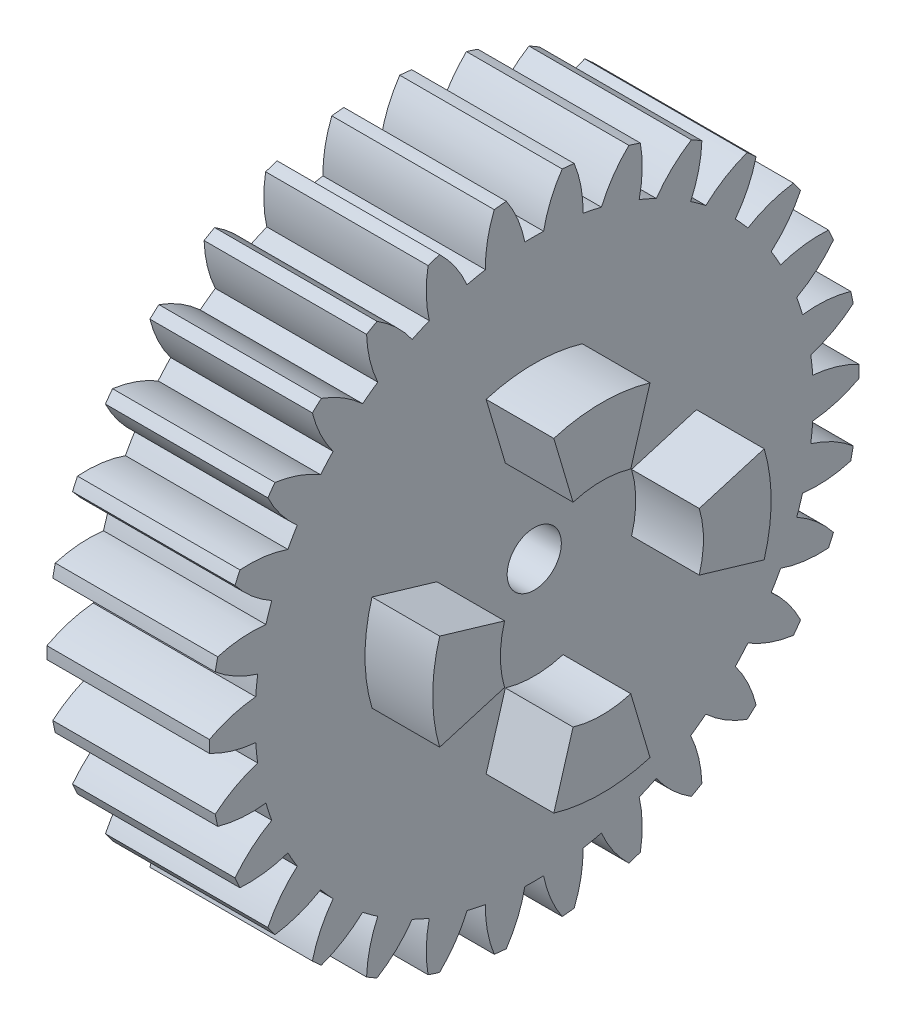
from build123d import *

# Parameters (mm, degrees)
BASPROSKE_W     = 12
BASPROSKE_H     = 24
TOOTHCUT_DEPTH  = 37
TEETHCUTS_COUNT = 30
TEETHCUTS_ANGLE = 348
BORSKE_R        = 2
BORE_DEPTH      = 50.0000508
EXTRUDE_1_DEPTH = 5


with BuildPart() as part:
    # BasProSke → Base-Revolve (revolve)
    with BuildSketch(Plane(origin=(0, 0, 0), x_dir=(1, 0, 0), z_dir=(0, 1, 0)), mode=Mode.PRIVATE) as base_revolve_sk:
        with Locations((6, 12)):
            Rectangle(BASPROSKE_W, BASPROSKE_H)
    revolve(base_revolve_sk.sketch.rotate(Axis((-10, 0, 0), (1, 0, 0)), 180), axis=Axis((-10, 0, 0), (1, 0, 0)))

    # TooCutSke → ToothCut (cut, through all)
    with BuildSketch(Plane(origin=(0, 0, 0), x_dir=(0, 0, -1), z_dir=(1, 0, 0))):
        with BuildLine():
            ThreePointArc((0.693278797, 20.612344372), (0, 20.624), (-0.693278797, 20.612344372))
            ThreePointArc((-0.693278797, 20.612344372), (-1.219042225, 22.34383125), (-2.080549663, 23.935144835))
            ThreePointArc((-2.080549663, 23.935144835), (0, 24.0254), (2.080549663, 23.935144835))
            ThreePointArc((2.080549663, 23.935144835), (1.219042225, 22.34383125), (0.693278797, 20.612344372))
        make_face()
    toothcut = extrude(amount=TOOTHCUT_DEPTH, mode=Mode.SUBTRACT)

    # TeethCuts: ToothCut ×30 about axis
    teethcuts_axis = Axis((-10, 0, 0), (1, 0, 0))
    for i in range(1, TEETHCUTS_COUNT):
        add(toothcut.rotate(teethcuts_axis, i * TEETHCUTS_ANGLE / (TEETHCUTS_COUNT - 1)), mode=Mode.SUBTRACT)

    # BorSke → Bore (cut, symmetric)
    with BuildSketch(Plane(origin=(0, 0, 0), x_dir=(0, 0, -1), z_dir=(1, 0, 0))):
        with Locations(Location((0, 0, 0), (0, 0, 180))):
            Circle(BORSKE_R)
    extrude(amount=BORE_DEPTH, both=True, mode=Mode.SUBTRACT)

    # 草图1 → 凸台-拉伸1 (add)
    with BuildSketch(Plane(origin=(12, 0, 0), x_dir=(0, 0, -1), z_dir=(1, 0, 0))):
        with BuildLine():
            Line((-2.13181457, 7.190644383), (-3.553024283, 11.984407305))
            ThreePointArc((-3.553024283, 11.984407305), (0, 12.5), (3.553024283, 11.984407305))
            Line((3.553024283, 11.984407305), (2.13181457, 7.190644383))
            ThreePointArc((2.13181457, 7.190644383), (0, 7.5), (-2.13181457, 7.190644383))
        make_face()
        with BuildLine():
            Line((7.190644383, 2.13181457), (11.984407305, 3.553024283))
            ThreePointArc((11.984407305, 3.553024283), (12.5, 0), (11.984407305, -3.553024283))
            Line((11.984407305, -3.553024283), (7.190644383, -2.13181457))
            ThreePointArc((7.190644383, -2.13181457), (7.5, 0), (7.190644383, 2.13181457))
        make_face()
        with BuildLine():
            Line((2.13181457, -7.190644383), (3.553024283, -11.984407305))
            ThreePointArc((3.553024283, -11.984407305), (0, -12.5), (-3.553024283, -11.984407305))
            Line((-3.553024283, -11.984407305), (-2.13181457, -7.190644383))
            ThreePointArc((-2.13181457, -7.190644383), (0, -7.5), (2.13181457, -7.190644383))
        make_face()
        with BuildLine():
            Line((-7.190644383, -2.13181457), (-11.984407305, -3.553024283))
            ThreePointArc((-11.984407305, -3.553024283), (-12.5, 0), (-11.984407305, 3.553024283))
            Line((-11.984407305, 3.553024283), (-7.190644383, 2.13181457))
            ThreePointArc((-7.190644383, 2.13181457), (-7.5, 0), (-7.190644383, -2.13181457))
        make_face()
    extrude_1 = extrude(amount=EXTRUDE_1_DEPTH)

    # 镜向1: 凸台-拉伸1 across plane
    add(extrude_1.mirror(Plane(origin=(6, 0, 0), x_dir=(0, 0, 1), z_dir=(1, 0, 0))))


solid = part.part
